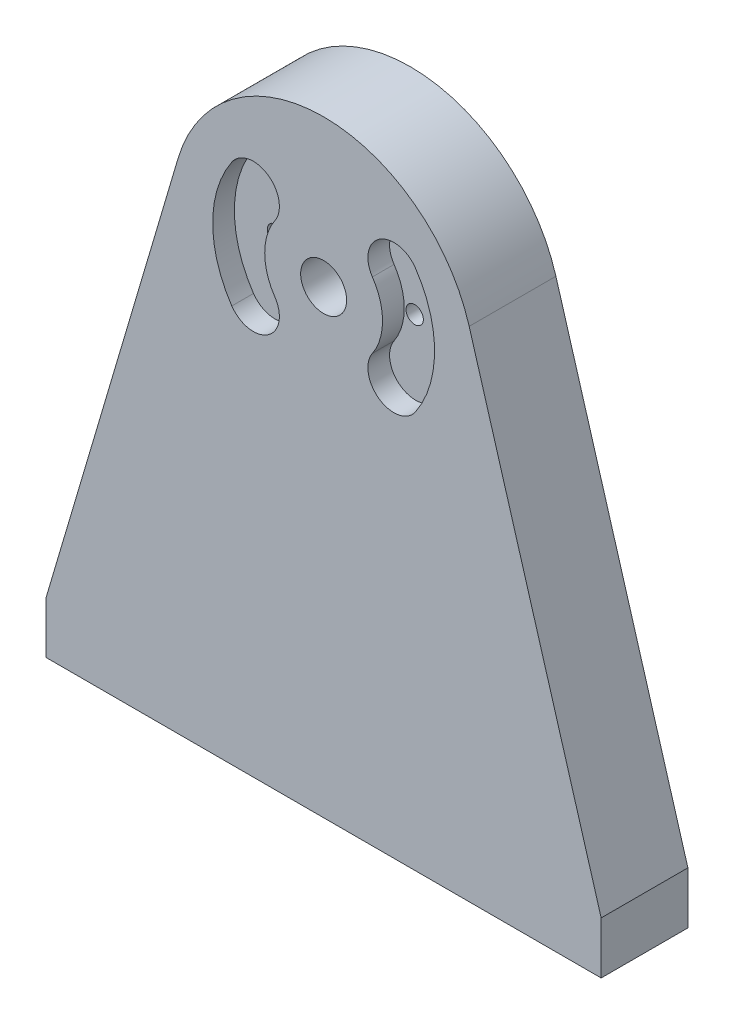
from build123d import *

# Parameters (mm, degrees)
EXTRUDE_1_DEPTH           = 5
HOLE_WIZARD_M5_1_D        = 5.3
CUT_EXTRUDE_1_DEPTH       = 2.5
HOLE_WIZARD_2_0_2_1_D     = 2
HOLE_WIZARD_2_0_2_1_DEPTH = 5
HOLE_WIZARD_2_0_2_2_D     = 2
HOLE_WIZARD_2_0_2_2_DEPTH = 55
HOLE_WIZARD_M5_2_D        = 5.3
HOLE_WIZARD_M5_2_DEPTH    = 12.4


with BuildPart() as part:
    # 스케치1 → 보스-돌출1 (new, symmetric)
    with BuildSketch(Plane.XY):
        with BuildLine():
            Line((-32, 0), (32, 0))
            Line((32, 0), (32, 6))
            Line((32, 6), (16.781610859, 57.462613925))
            ThreePointArc((16.781610859, 57.462613925), (0, 70), (-16.781610859, 57.462613925))
            Line((-16.781610859, 57.462613925), (-32, 6))
            Line((-32, 6), (-32, 0))
        make_face()
    extrude(amount=EXTRUDE_1_DEPTH, both=True)

    # M5 여유 구멍1 (through all)
    with Locations(Plane.XY.offset(5)):
        with Locations((0, 53)):
            Hole(HOLE_WIZARD_M5_1_D / 2)

    # 스케치4 → 컷-돌출1 (cut)
    with BuildSketch(Plane.XY.offset(5)):
        with BuildLine():
            ThreePointArc((-10.585585486, 60.184777453), (-12.793578355, 53), (-10.585585486, 45.815222547))
            ThreePointArc((-10.585585486, 45.815222547), (-6.418566116, 45.017758083), (-5.621101652, 49.184777453))
            ThreePointArc((-5.621101652, 49.184777453), (-6.793578355, 53), (-5.621101652, 56.815222547))
            ThreePointArc((-5.621101652, 56.815222547), (-6.418566116, 60.982241917), (-10.585585486, 60.184777453))
        make_face()
    cut_extrude_1 = extrude(amount=-CUT_EXTRUDE_1_DEPTH, mode=Mode.SUBTRACT)

    # Ø2.0 (2) 지름 구멍1
    with Locations(Plane.XY.offset(5)):
        with Locations((-8, 53)):
            hole_wizard_2_0_2_1 = Hole(HOLE_WIZARD_2_0_2_1_D / 2, depth=HOLE_WIZARD_2_0_2_1_DEPTH)

    # 대칭 복사1: 컷-돌출1, Ø2.0 (2) 지름 구멍1 across plane
    add(cut_extrude_1.mirror(Plane(origin=(0, 0, 0), x_dir=(0, 0, 1), z_dir=(1, 0, 0))), mode=Mode.SUBTRACT)
    add(hole_wizard_2_0_2_1.mirror(Plane(origin=(0, 0, 0), x_dir=(0, 0, 1), z_dir=(1, 0, 0))), mode=Mode.SUBTRACT)

    # Ø2.0 (2) 지름 구멍2
    with Locations(Plane(origin=(0, 0, 0), x_dir=(-1, 0, 0), z_dir=(0, -1, 0))):
        with Locations((-8, 0), (8, 0)):
            Hole(HOLE_WIZARD_2_0_2_2_D / 2, depth=HOLE_WIZARD_2_0_2_2_DEPTH)

    # M5 여유 구멍2
    with Locations(Plane(origin=(0, 0, 0), x_dir=(-1, 0, 0), z_dir=(0, -1, 0))):
        with Locations((-22, 0), (22, 0)):
            Hole(HOLE_WIZARD_M5_2_D / 2, depth=HOLE_WIZARD_M5_2_DEPTH)


solid = part.part
